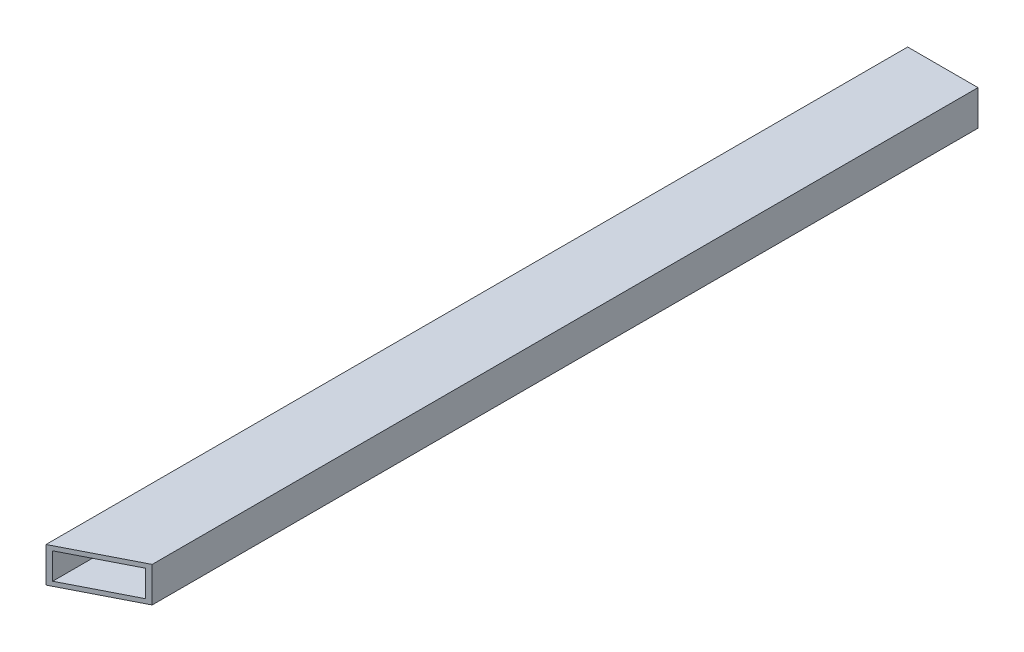
from build123d import *

# Parameters (mm, degrees)
SKETCH2_W           = 50.8
SKETCH2_H           = 25.4
SKETCH2_W_2         = 44.45
SKETCH2_H_2         = 19.05
BOSS_EXTRUDE1_DEPTH = 622.3
CUT_EXTRUDE1_REACH  = 625.336


with BuildPart() as part:
    # Sketch2 → Boss-Extrude1 (new body)
    with BuildSketch(Plane.XY):
        Rectangle(SKETCH2_W, SKETCH2_H)
        Rectangle(SKETCH2_W_2, SKETCH2_H_2, mode=Mode.SUBTRACT)
    extrude(amount=BOSS_EXTRUDE1_DEPTH)

    # Cut-Extrude1: up to this face of the body (flat: up to its plane)
    cut_extrude1_end = Plane(part.part.faces().sort_by_distance((0, -12.7, 311.15))[0])
    # Sketch3 → Cut-Extrude1 (cut, up to the picked face)
    with BuildSketch(Plane(origin=(0, 12.7, 0), x_dir=(1, 0, 0), z_dir=(0, 1, 0)), mode=Mode.PRIVATE) as cut_extrude1_sk1:
        Polygon((-25.4, -622.3), (25.4, -596.416107166), (25.4, -622.3), align=None)
    cut_extrude1_tool1 = split(extrude(cut_extrude1_sk1.sketch, amount=-CUT_EXTRUDE1_REACH, mode=Mode.PRIVATE), bisect_by=cut_extrude1_end, keep=Keep.BOTH, mode=Mode.PRIVATE)
    add(cut_extrude1_tool1.solids().sort_by(Axis((8.466667, 12.7, 613.672036), (0, -1, 0)))[0], mode=Mode.SUBTRACT)


solid = part.part
